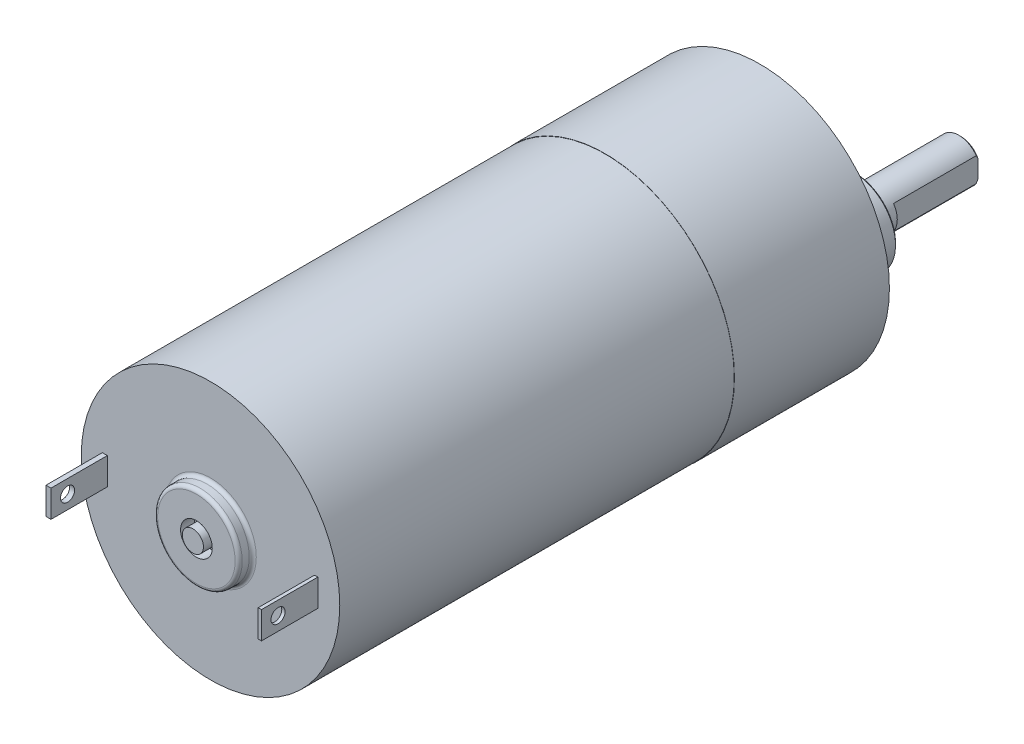
from build123d import *

# Parameters (mm, degrees)
ESQUISSE1_R                = 18.385
BOSS_EXTRU_1_DEPTH         = 22
ESQUISSE2_R                = 18.35
BOSS_EXTRU_2_DEPTH         = 56
ESQUISSE3_R                = 6
BOSS_EXTRU_3_DEPTH         = 2
CONG_1_R                   = 0.5
ESQUISSE4_R                = 2.25
ENL_V_MAT_EXTRU_1_DEPTH    = 2
ESQUISSE5_R                = 1.5
BOSS_EXTRU_4_DEPTH         = 2.5
ESQUISSE7_R                = 15.5
ESQUISSE7_R_2              = 15.25
BOSS_EXTRU_5_DEPTH         = 50
ESQUISSE8_R                = 6
BOSS_EXTRU_6_DEPTH         = 6
ESQUISSE9_R                = 3
BOSS_EXTRU_7_DEPTH         = 15
ESQUISSE10_W               = 4.530237875
ESQUISSE10_H               = 3.434181126
ENL_V_MAT_EXTRU_5_DEPTH    = 12
ENL_V_MAT_EXTRU_6_DEPTH    = 1
CONG_2_R                   = 0.25
CHANFREIN1_SIZE            = 0.25
TROU_TARAUD_M31_AT_2_COUNT = 2
TROU_TARAUD_M31_AT_2_PITCH = 15.5
TROU_TARAUD_M31_AT_3_COUNT = 2
TROU_TARAUD_M31_AT_3_PITCH = 26.846787517
TROU_TARAUD_M31_AT_4_COUNT = 2
TROU_TARAUD_M31_AT_4_PITCH = 31
TROU_TARAUD_M31_AT_5_COUNT = 2
TROU_TARAUD_M31_AT_5_PITCH = 26.846787517
TROU_TARAUD_M31_AT_6_COUNT = 2
TROU_TARAUD_M31_AT_6_PITCH = 15.5
ESQUISSE14_W               = 0.472417348
ESQUISSE14_H               = 3.85
ESQUISSE14_W_2             = 0.70862602
BOSS_EXTRU_8_DEPTH         = 8
ESQUISSE15_R               = 1
ENL_V_MAT_EXTRU_7_DEPTH    = 38


with BuildPart() as part:
    # Esquisse1 → Boss.-Extru.1 (new body)
    with BuildSketch(Plane.XY):
        Circle(ESQUISSE1_R)
    extrude(amount=BOSS_EXTRU_1_DEPTH)

    # Esquisse2 → Boss.-Extru.2 (add)
    with BuildSketch(Plane.XY.offset(22)):
        Circle(ESQUISSE2_R)
    extrude(amount=BOSS_EXTRU_2_DEPTH)

    # Esquisse3 → Boss.-Extru.3 (add)
    with BuildSketch(Plane.XY.offset(78)):
        Circle(ESQUISSE3_R)
    extrude(amount=BOSS_EXTRU_3_DEPTH)

    # Congé1
    cong_1_edges = [part.edges().sort_by_distance(p)[0] for p in [
        (-6, 0, 80),
        (-6, 0, 78),
    ]]
    fillet(cong_1_edges, radius=CONG_1_R)

    # Esquisse4 → Enlèv. mat.-Extru.1 (cut)
    with BuildSketch(Plane.XY.offset(80)):
        Circle(ESQUISSE4_R)
    extrude(amount=-ENL_V_MAT_EXTRU_1_DEPTH, mode=Mode.SUBTRACT)

    # Esquisse5 → Boss.-Extru.4 (add)
    with BuildSketch(Plane.XY.offset(78)):
        Circle(ESQUISSE5_R)
    extrude(amount=BOSS_EXTRU_4_DEPTH)

    # Esquisse11 → Enlèv. mat.-Extru.6 (cut)
    with BuildSketch(Plane(origin=(0, 0, 0), x_dir=(-1, 0, 0), z_dir=(0, 0, -1))):
        with BuildLine():
            ThreePointArc((-12.15, -5.884513574), (13.5, 0), (-12.15, 5.884513574))
            ThreePointArc((-12.15, 5.884513574), (0, 0), (-12.15, -5.884513574))
        make_face()
    extrude(amount=-ENL_V_MAT_EXTRU_6_DEPTH, mode=Mode.SUBTRACT)

    # Congé2
    cong_2_edges = [part.edges().sort_by_distance(p)[0] for p in [
        (-13.5, 0, 0),
        (0, 0, 0),
        (-13.5, 0, 1),
        (0, 0, 1),
    ]]
    fillet(cong_2_edges, radius=CONG_2_R)

    # Esquisse13 → Trou taraudé M31 (revolve, cut)
    with BuildSketch(Plane(origin=(0, 15.5, 0), x_dir=(0, 1, 0), z_dir=(1, 0, 0))):
        Polygon((0, 0), (0, 5.751075774), (1.25, 5), (1.25, 0), align=None)
    trou_taraud_m31 = revolve(axis=Axis((0, 15.5, -6.35), (0, 0, 1)), mode=Mode.SUBTRACT)

    # Trou taraudé M31 at 2: Trou taraudé M31 ×2
    with Locations(*[Vector(0.8660254037844101, -0.5000000000000495, 0) * (i * TROU_TARAUD_M31_AT_2_PITCH) for i in range(1, TROU_TARAUD_M31_AT_2_COUNT)]):
        add(trou_taraud_m31, mode=Mode.SUBTRACT)

    # Trou taraudé M31 at 3: Trou taraudé M31 ×2
    with Locations(*[Vector(0.49999999999995065, -0.8660254037844671, 0) * (i * TROU_TARAUD_M31_AT_3_PITCH) for i in range(1, TROU_TARAUD_M31_AT_3_COUNT)]):
        add(trou_taraud_m31, mode=Mode.SUBTRACT)

    # Trou taraudé M31 at 4: Trou taraudé M31 ×2
    with Locations(*[(0, -i * TROU_TARAUD_M31_AT_4_PITCH, 0) for i in range(1, TROU_TARAUD_M31_AT_4_COUNT)]):
        add(trou_taraud_m31, mode=Mode.SUBTRACT)

    # Trou taraudé M31 at 5: Trou taraudé M31 ×2
    with Locations(*[Vector(-0.5000000000000493, -0.8660254037844103, 0) * (i * TROU_TARAUD_M31_AT_5_PITCH) for i in range(1, TROU_TARAUD_M31_AT_5_COUNT)]):
        add(trou_taraud_m31, mode=Mode.SUBTRACT)

    # Trou taraudé M31 at 6: Trou taraudé M31 ×2
    with Locations(*[Vector(-0.866025403784467, -0.49999999999995076, 0) * (i * TROU_TARAUD_M31_AT_6_PITCH) for i in range(1, TROU_TARAUD_M31_AT_6_COUNT)]):
        add(trou_taraud_m31, mode=Mode.SUBTRACT)

    # Esquisse14 → Boss.-Extru.8 (add)
    with BuildSketch(Plane.XY.offset(78)):
        with Locations((15, 0)):
            Rectangle(ESQUISSE14_W, ESQUISSE14_H)
        with Locations((-15, 0)):
            Rectangle(ESQUISSE14_W_2, ESQUISSE14_H)
    extrude(amount=BOSS_EXTRU_8_DEPTH)

    # Esquisse15 → Enlèv. mat.-Extru.7 (cut)
    with BuildSketch(Plane.ZY.offset(15.35431301)):
        with Locations((83.648419572, 0)):
            Circle(ESQUISSE15_R)
    extrude(amount=-ENL_V_MAT_EXTRU_7_DEPTH, mode=Mode.SUBTRACT)


with BuildPart() as body_2:
    # Esquisse7 → Boss.-Extru.5 (new body)
    with BuildSketch(Plane.XY.offset(74.5)):
        Circle(ESQUISSE7_R)
        Circle(ESQUISSE7_R_2, mode=Mode.SUBTRACT)
    extrude(amount=-BOSS_EXTRU_5_DEPTH)


with BuildPart() as body_3:
    # Esquisse8 → Boss.-Extru.6 (new body)
    with BuildSketch(Plane(origin=(0, 0, 0), x_dir=(-1, 0, 0), z_dir=(0, 0, -1))):
        with Locations((-7.5, 0)):
            Circle(ESQUISSE8_R)
    extrude(amount=BOSS_EXTRU_6_DEPTH)

    # Esquisse9 → Boss.-Extru.7 (add)
    with BuildSketch(Plane(origin=(0, 0, -6), x_dir=(-1, 0, 0), z_dir=(0, 0, -1))):
        with Locations((-7.5, 0)):
            Circle(ESQUISSE9_R)
    extrude(amount=BOSS_EXTRU_7_DEPTH)

    # Esquisse10 → Enlèv. mat.-Extru.5 (cut)
    with BuildSketch(Plane(origin=(0, 0, -21), x_dir=(-1, 0, 0), z_dir=(0, 0, -1))):
        with Locations((-12.225118937, 0)):
            Rectangle(ESQUISSE10_W, ESQUISSE10_H)
    extrude(amount=-ENL_V_MAT_EXTRU_5_DEPTH, mode=Mode.SUBTRACT)

    # Chanfrein1
    chanfrein1_edges = [body_3.edges().sort_by_distance(p)[0] for p in [
        (13.5, 0, -6),
        (6.6, -2.861817604, -21),
    ]]
    chamfer(chanfrein1_edges, length=CHANFREIN1_SIZE)


solid = Compound([part.part, body_2.part, body_3.part])
